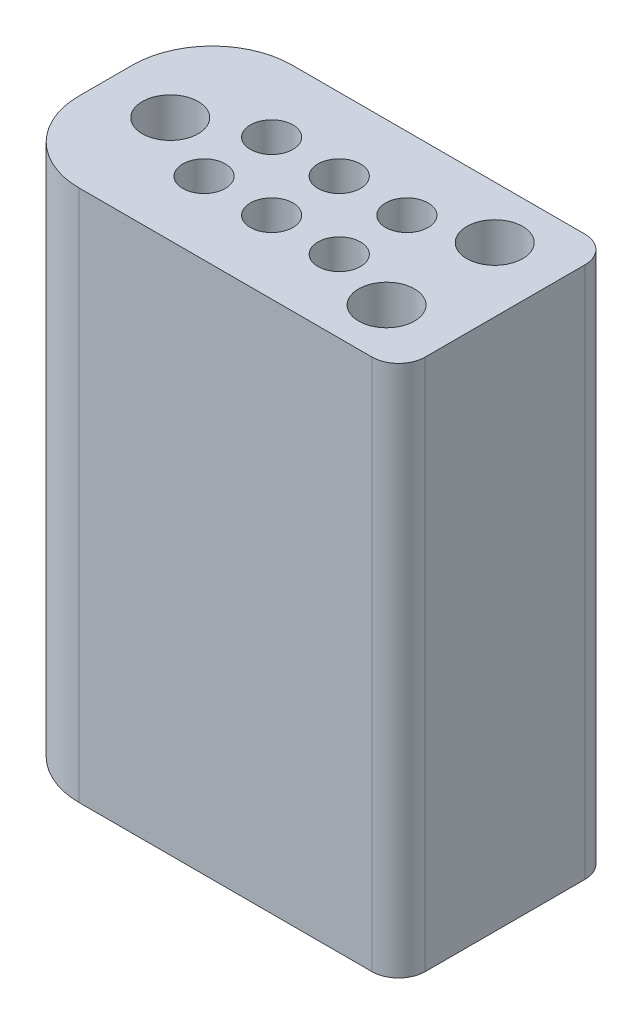
from build123d import *

# Parameters (mm, degrees)
SKETCH1_R           = 0.4
SKETCH1_R_2         = 0.525
BOSS_EXTRUDE1_DEPTH = 10


with BuildPart() as part:
    # Sketch1 → Boss-Extrude1 (new body)
    with BuildSketch(Plane(origin=(0, 0, 0), x_dir=(1, 0, 0), z_dir=(0, 1, 0))):
        with BuildLine():
            Line((-2.25, 2), (3.25, 2))
            ThreePointArc((3.25, 2), (3.603553391, 1.853553391), (3.75, 1.5))
            Line((3.75, 1.5), (3.75, -1.5))
            ThreePointArc((3.75, -1.5), (3.603553391, -1.853553391), (3.25, -2))
            Line((3.25, -2), (-2.25, -2))
            ThreePointArc((-2.25, -2), (-3.310660172, -1.560660172), (-3.75, -0.5))
            Line((-3.75, -0.5), (-3.75, 0.5))
            ThreePointArc((-3.75, 0.5), (-3.310660172, 1.560660172), (-2.25, 2))
        make_face()
        with Locations(Location((0, 0.635, 0), (0, 0, 270))):
            Circle(SKETCH1_R, mode=Mode.SUBTRACT)
        with Locations(Location((0, -0.635, 0), (0, 0, 270))):
            Circle(SKETCH1_R, mode=Mode.SUBTRACT)
        with Locations(Location((-1.27, -0.635, 0), (0, 0, 270))):
            Circle(SKETCH1_R, mode=Mode.SUBTRACT)
        with Locations(Location((-1.27, 0.635, 0), (0, 0, 270))):
            Circle(SKETCH1_R, mode=Mode.SUBTRACT)
        with Locations(Location((1.27, 0.635, 0), (0, 0, 270))):
            Circle(SKETCH1_R, mode=Mode.SUBTRACT)
        with Locations(Location((1.27, -0.635, 0), (0, 0, 270))):
            Circle(SKETCH1_R, mode=Mode.SUBTRACT)
        with Locations(Location((2.54, 1.016, 0), (0, 0, 270))):
            Circle(SKETCH1_R_2, mode=Mode.SUBTRACT)
        with Locations(Location((2.54, -1.016, 0), (0, 0, 270))):
            Circle(SKETCH1_R_2, mode=Mode.SUBTRACT)
        with Locations(Location((-2.54, 0, 0), (0, 0, 270))):
            Circle(SKETCH1_R_2, mode=Mode.SUBTRACT)
    extrude(amount=BOSS_EXTRUDE1_DEPTH)


solid = part.part
